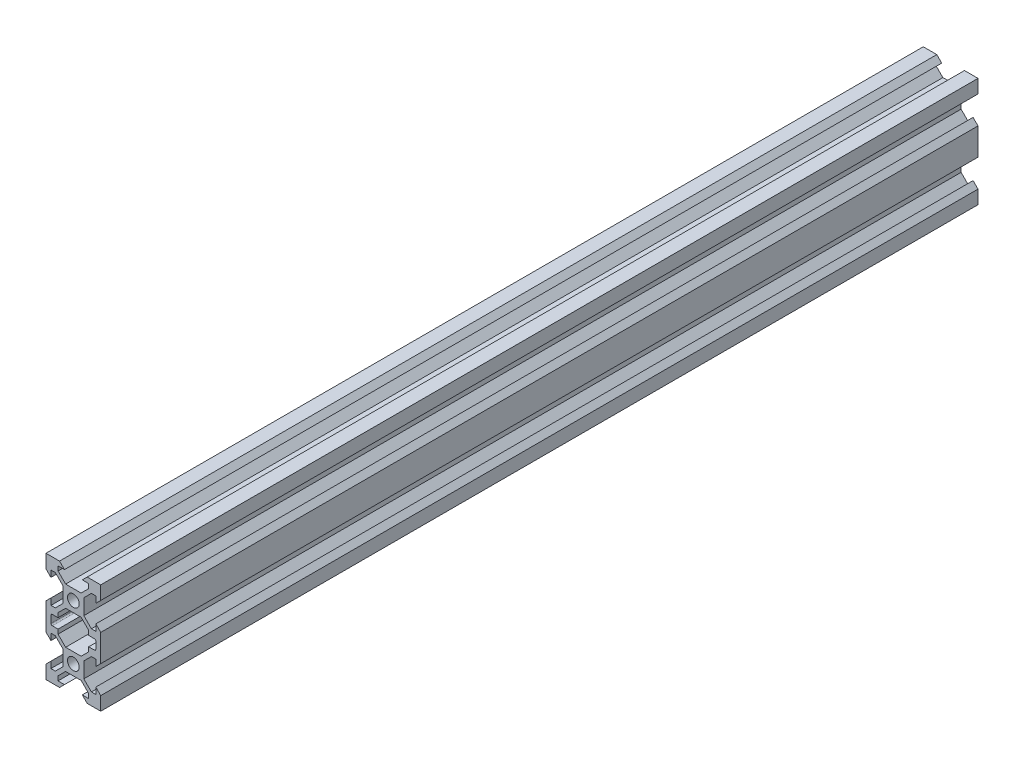
from build123d import *

# Parameters (mm, degrees)
CROQUIS1_R              = 2.15
SALIENTE_EXTRUIR1_DEPTH = 320.6


with BuildPart() as part:
    # Croquis1 → Saliente-Extruir1 (new body)
    with BuildSketch(Plane.XY):
        Polygon((20, 4.95), (18.2, 6.75), (18.2, 4.4), (16.589949494, 4.4), (13.825, 7.164949494), (13.825, 12.835050506), (16.589949494, 15.6), (18.2, 15.6), (18.2, 13.25), (20, 15.05), (20, 20), (15.05, 20), (13.25, 18.2), (15.6, 18.2), (15.6, 16.589949494), (12.835050506, 13.825), (7.164949494, 13.825), (4.4, 16.589949494), (4.4, 18.2), (6.75, 18.2), (4.95, 20), (0, 20), (0, 15.05), (1.8, 13.25), (1.8, 15.6), (3.410050506, 15.6), (6.175, 12.835050506), (6.175, 7.164949494), (3.410050506, 4.4), (1.8, 4.4), (1.8, 6.75), (0, 4.95), (0, -4.95), (1.8, -6.75), (1.8, -4.4), (3.410050506, -4.4), (6.175, -7.164949494), (6.175, -12.835050506), (3.410050506, -15.6), (1.8, -15.6), (1.8, -13.25), (0, -15.05), (0, -20), (4.95, -20), (6.75, -18.2), (4.4, -18.2), (4.4, -16.589949494), (7.164949494, -13.825), (12.835050506, -13.825), (15.6, -16.589949494), (15.6, -18.2), (13.25, -18.2), (15.05, -20), (20, -20), (20, -15.05), (18.2, -13.25), (18.2, -15.6), (16.589949494, -15.6), (13.825, -12.835050506), (13.825, -7.164949494), (16.589949494, -4.4), (18.2, -4.4), (18.2, -6.75), (20, -4.95), align=None)
        with BuildLine():
            Line((1.8, -1.3), (1.8, 1.3))
            ThreePointArc((1.8, 1.3), (1.946446609, 1.653553391), (2.3, 1.8))
            Line((2.3, 1.8), (4.4, 1.8))
            Line((4.4, 1.8), (4.4, 3.410050506))
            Line((4.4, 3.410050506), (7.164949494, 6.175))
            Line((7.164949494, 6.175), (12.835050506, 6.175))
            Line((12.835050506, 6.175), (15.6, 3.410050506))
            Line((15.6, 3.410050506), (15.6, 1.8))
            Line((15.6, 1.8), (17.7, 1.8))
            ThreePointArc((17.7, 1.8), (18.053553391, 1.653553391), (18.2, 1.3))
            Line((18.2, 1.3), (18.2, -1.3))
            ThreePointArc((18.2, -1.3), (18.053553391, -1.653553391), (17.7, -1.8))
            Line((17.7, -1.8), (15.6, -1.8))
            Line((15.6, -1.8), (15.6, -3.410050506))
            Line((15.6, -3.410050506), (12.835050506, -6.175))
            Line((12.835050506, -6.175), (7.164949494, -6.175))
            Line((7.164949494, -6.175), (4.4, -3.410050506))
            Line((4.4, -3.410050506), (4.4, -1.8))
            Line((4.4, -1.8), (2.3, -1.8))
            ThreePointArc((2.3, -1.8), (1.946446609, -1.653553391), (1.8, -1.3))
        make_face(mode=Mode.SUBTRACT)
        with Locations((10, -10)):
            Circle(CROQUIS1_R, mode=Mode.SUBTRACT)
        with Locations((10, 10)):
            Circle(CROQUIS1_R, mode=Mode.SUBTRACT)
    extrude(amount=SALIENTE_EXTRUIR1_DEPTH)


solid = part.part
